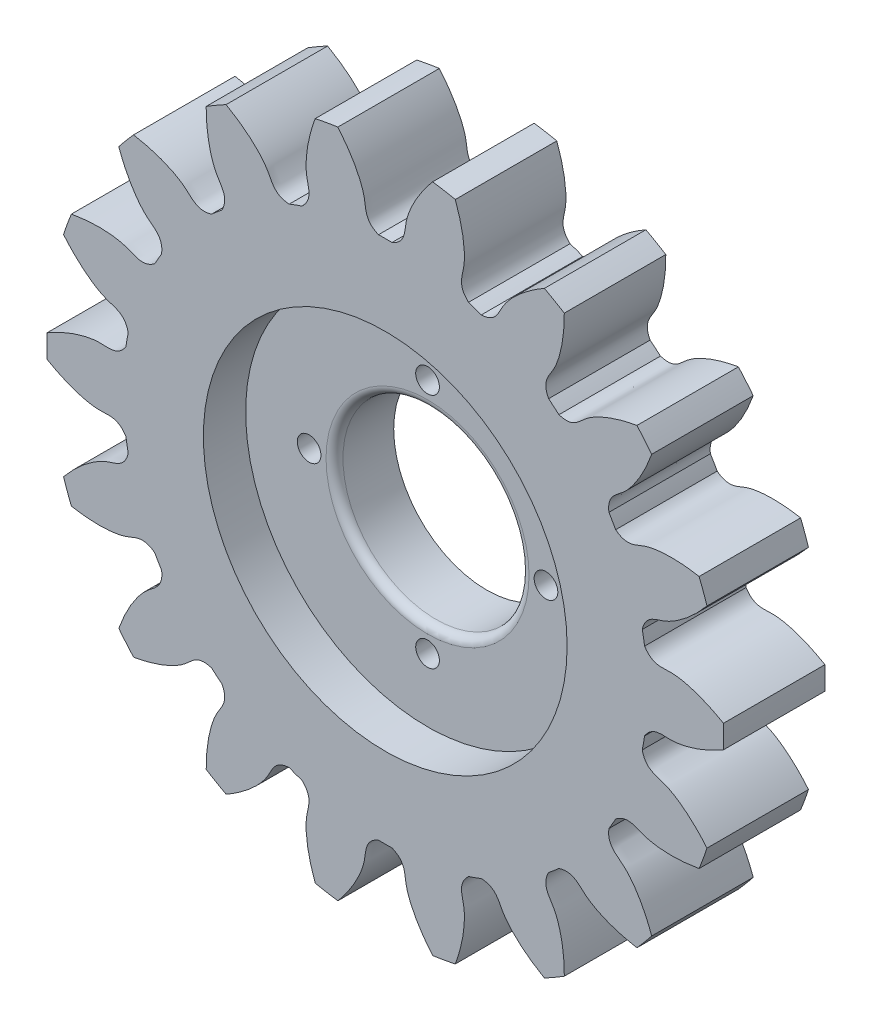
from build123d import *
from build123d.topology import SkipClean

# Parameters (mm, degrees)
SKETCH_1_R               = 20
EXTRUDE_1_DEPTH          = 5
CUT_EXTRUDE_1_DEPTH      = 29.722813233
PATTERN_CIRCULAR_1_COUNT = 18
SKETCH_4_R               = 10.75
CUT_EXTRUDE_2_DEPTH      = 2.5
SKETCH_5_R               = 5.5
CUT_EXTRUDE_3_DEPTH      = 12.5
EXTRUDE_START            = 1
SKETCH_7_R               = 5.5
EXTRUDE_2_DEPTH          = 1
SKETCH_9_R               = 0.7
CUT_EXTRUDE_4_DEPTH      = 11
FILLET_1_R               = 0.5


with BuildPart() as part:
    # 草图1 → 凸台-拉伸1 (new body)
    with BuildSketch(Plane.XY):
        Circle(SKETCH_1_R)
    extrude(amount=EXTRUDE_1_DEPTH)

    # 草图2 → 切除-拉伸1 (cut, through all)
    with BuildSketch(Plane.XY):
        with BuildLine():
            ThreePointArc((0.398807118, 15.494868598), (0, 15.5), (-0.398807118, 15.494868598))
            add(Edge.make_bspline(
                [(-0.398807118, 15.494868598), (-1.23020808, 15.837360781), (-1.1255781, 16.477399004), (-1.263665829, 17.085190913), (-1.27750304, 17.141013201), (-1.294215187, 17.203080949), (-1.314049419, 17.271300365), (-1.337260061, 17.345568336), (-1.364095436, 17.425774664), (-1.394801707, 17.511801464), (-1.429621434, 17.603523458), (-1.46879375, 17.700807993), (-1.512554053, 17.803515157), (-1.561133842, 17.911497864), (-1.614760517, 18.02460196), (-1.673657194, 18.142666331), (-1.738042511, 18.265523008), (-1.80813045, 18.392997287), (-1.884130152, 18.524907848), (-1.96624574, 18.661066879), (-2.054676143, 18.801280205), (-2.149614924, 18.945347423), (-2.25125011, 19.09306204), (-2.359764029, 19.244211611), (-2.475333142, 19.398577891), (-2.598127894, 19.555936981), (-2.728312549, 19.716059488), (-2.866045047, 19.878710674), (-3.011476851, 20.043650629), (-3.164752807, 20.210634428), (-3.326011005, 20.379412306), (-3.495382642, 20.549729829), (-3.672991892, 20.72132807), (-3.858955782, 20.893943792), (-4.053384065, 21.067309626), (-4.256379108, 21.241154261), (-4.468035775, 21.415202635), (-4.68844132, 21.58917612), (-4.917675281, 21.762792726), (-5.155809396, 21.935767291), (-5.402907448, 22.107811691), (-5.748150706, 22.338079033), (-6.015110877, 22.504667558), (-6.197121782, 22.613356759)],
                knots=[0, 0, 0, 0, 0.187591972, 0.192996016, 0.1991206, 0.205965723, 0.213531386, 0.221817587, 0.230824328, 0.240551609, 0.250999428, 0.262167787, 0.274056685, 0.286666122, 0.299996099, 0.314046614, 0.32881767, 0.344309264, 0.360521397, 0.37745407, 0.395107283, 0.413481034, 0.432575325, 0.452390155, 0.472925524, 0.494181432, 0.51615788, 0.538854867, 0.562272393, 0.586410459, 0.611269064, 0.636848208, 0.663147891, 0.690168114, 0.717908876, 0.746370177, 0.775552017, 0.805454397, 0.836077316, 0.867420774, 0.899484772, 0.932269309, 1, 1, 1, 1], degree=3))
            ThreePointArc((-6.197121782, 22.613356759), (0, 23.447136761), (6.197121782, 22.613356759))
            add(Edge.make_bspline(
                [(0.398807118, 15.494868598), (1.23020808, 15.837360781), (1.1255781, 16.477399004), (1.263665829, 17.085190913), (1.27750304, 17.141013201), (1.294215187, 17.203080949), (1.314049419, 17.271300365), (1.337260061, 17.345568336), (1.364095436, 17.425774664), (1.394801707, 17.511801464), (1.429621434, 17.603523458), (1.46879375, 17.700807993), (1.512554053, 17.803515157), (1.561133842, 17.911497864), (1.614760517, 18.02460196), (1.673657194, 18.142666331), (1.738042511, 18.265523008), (1.80813045, 18.392997287), (1.884130152, 18.524907848), (1.96624574, 18.661066879), (2.054676143, 18.801280205), (2.149614924, 18.945347423), (2.25125011, 19.09306204), (2.359764029, 19.244211611), (2.475333142, 19.398577891), (2.598127894, 19.555936981), (2.728312549, 19.716059488), (2.866045047, 19.878710674), (3.011476851, 20.043650629), (3.164752807, 20.210634428), (3.326011005, 20.379412306), (3.495382642, 20.549729829), (3.672991892, 20.72132807), (3.858955782, 20.893943792), (4.053384065, 21.067309626), (4.256379108, 21.241154261), (4.468035775, 21.415202635), (4.68844132, 21.58917612), (4.917675281, 21.762792726), (5.155809396, 21.935767291), (5.402907448, 22.107811691), (5.748150706, 22.338079033), (6.015110877, 22.504667558), (6.197121782, 22.613356759)],
                knots=[0, 0, 0, 0, 0.187591972, 0.192996016, 0.1991206, 0.205965723, 0.213531386, 0.221817587, 0.230824328, 0.240551609, 0.250999428, 0.262167787, 0.274056685, 0.286666122, 0.299996099, 0.314046614, 0.32881767, 0.344309264, 0.360521397, 0.37745407, 0.395107283, 0.413481034, 0.432575325, 0.452390155, 0.472925524, 0.494181432, 0.51615788, 0.538854867, 0.562272393, 0.586410459, 0.611269064, 0.636848208, 0.663147891, 0.690168114, 0.717908876, 0.746370177, 0.775552017, 0.805454397, 0.836077316, 0.867420774, 0.899484772, 0.932269309, 1, 1, 1, 1], degree=3))
        make_face()
    cut_extrude_1 = extrude(amount=CUT_EXTRUDE_1_DEPTH, mode=Mode.SUBTRACT)

    # 阵列(圆周)1: 切除-拉伸1 ×18 about axis
    pattern_circular_1_axis = Axis((0, 0, -0.25), (0, 0, 1))
    for i in range(1, PATTERN_CIRCULAR_1_COUNT):
        add(cut_extrude_1.rotate(pattern_circular_1_axis, i * 360 / PATTERN_CIRCULAR_1_COUNT), mode=Mode.SUBTRACT)

    # 草图4 → 切除-拉伸2 (cut)
    with BuildSketch(Plane.XY.offset(5)):
        Circle(SKETCH_4_R)
    extrude(amount=-CUT_EXTRUDE_2_DEPTH, mode=Mode.SUBTRACT)

    # 草图5 → 切除-拉伸3 (cut)
    with BuildSketch(Plane.XY.offset(2.5)):
        Circle(SKETCH_5_R)
    extrude(amount=-CUT_EXTRUDE_3_DEPTH, mode=Mode.SUBTRACT)

    # 草图7 → 凸台-拉伸2 (add)
    with BuildSketch(Plane(origin=(0, 0, 0), x_dir=(-1, 0, 0), z_dir=(0, 0, -1)).offset(EXTRUDE_START)):
        with BuildLine():
            ThreePointArc((5.674313285, 14.424013614), (5.301312222, 14.565235622), (4.924801073, 14.69681375))
            add(Edge.make_bspline(
                [(4.924801073, 14.69681375), (4.26067895, 15.303007003), (4.577904934, 15.868660637), (4.658707402, 16.508284432), (4.666369027, 16.589127112), (4.672330084, 16.679144875), (4.675920357, 16.756872447), (4.678135533, 16.841419979), (4.678921527, 16.967718525), (4.674597452, 17.142482832), (4.659749506, 17.37208574), (4.632937235, 17.62783527), (4.592050527, 17.909098716), (4.53501208, 18.215116724), (4.459784588, 18.545004881), (4.364377308, 18.89775579), (4.256548047, 19.24134761), (4.177244393, 19.466051115), (4.139957978, 19.566827743)],
                knots=[0, 0, 0, 0, 0.187591972, 0.192996016, 0.205965723, 0.213531386, 0.221817587, 0.230824328, 0.240551609, 0.262167787, 0.286666122, 0.314046614, 0.344309264, 0.37745407, 0.413481034, 0.452390155, 0.494181432, 0.528511939, 0.528511939, 0.528511939, 0.528511939], degree=3))
            ThreePointArc((4.139957978, 19.566827743), (3.472963553, 19.69615506), (2.801961267, 19.802752664))
            add(Edge.make_bspline(
                [(2.801961267, 19.802752664), (2.689421233, 19.670068814), (2.500770995, 19.436321364), (2.253649449, 19.099646255), (2.056924342, 18.807881579), (1.886229548, 18.53152491), (1.739995333, 18.272154487), (1.634568569, 18.066379149), (1.545190776, 17.877872321), (1.483536019, 17.737420453), (1.429621434, 17.603523458), (1.394801707, 17.511801464), (1.364095436, 17.425774664), (1.337260061, 17.345568336), (1.314049419, 17.271300365), (1.288863092, 17.184672535), (1.268412839, 17.106084836), (1.1255781, 16.477399004), (1.23020808, 15.837360781), (0.398807118, 15.494868598)],
                knots=[0.471488061, 0.471488061, 0.471488061, 0.471488061, 0.527074476, 0.567424675, 0.604892717, 0.639478603, 0.67118233, 0.700003901, 0.713333878, 0.737832213, 0.749000572, 0.759448391, 0.769175672, 0.778182413, 0.786468614, 0.794034277, 0.807003984, 0.812408028, 1, 1, 1, 1], degree=3))
            ThreePointArc((0.398807118, 15.494868598), (0, 15.5), (-0.398807118, 15.494868598))
            add(Edge.make_bspline(
                [(-0.398807118, 15.494868598), (-1.23020808, 15.837360781), (-1.1255781, 16.477399004), (-1.268412839, 17.106084836), (-1.288863092, 17.184672535), (-1.314049419, 17.271300365), (-1.337260061, 17.345568336), (-1.364095436, 17.425774664), (-1.40655349, 17.544725301), (-1.470389704, 17.70747111), (-1.562871029, 17.918148971), (-1.675537813, 18.149304581), (-1.810156515, 18.399621688), (-1.968419446, 18.667676254), (-2.15193856, 18.951940403), (-2.362239993, 19.250786618), (-2.581081677, 19.536777536), (-2.73245586, 19.720806314), (-2.801961267, 19.802752664)],
                knots=[0, 0, 0, 0, 0.187591972, 0.192996016, 0.205965723, 0.213531386, 0.221817587, 0.230824328, 0.240551609, 0.262167787, 0.286666122, 0.314046614, 0.344309264, 0.37745407, 0.413481034, 0.452390155, 0.494181432, 0.528511939, 0.528511939, 0.528511939, 0.528511939], degree=3))
            ThreePointArc((-2.801961267, 19.802752664), (-3.472963553, 19.69615506), (-4.139957978, 19.566827743))
            add(Edge.make_bspline(
                [(-4.139957978, 19.566827743), (-4.200330468, 19.403654751), (-4.297657369, 19.119481815), (-4.414725993, 18.718590153), (-4.499797728, 18.377137091), (-4.565678818, 18.05906571), (-4.614384122, 17.765322191), (-4.643073564, 17.535898547), (-4.662588084, 17.328191066), (-4.672487236, 17.175122313), (-4.677354904, 17.030860421), (-4.678703975, 16.932760892), (-4.678135533, 16.841419979), (-4.675920357, 16.756872447), (-4.672330084, 16.679144875), (-4.666369027, 16.589127112), (-4.658707402, 16.508284432), (-4.577904934, 15.868660637), (-4.26067895, 15.303007003), (-4.924801073, 14.69681375)],
                knots=[0.471488061, 0.471488061, 0.471488061, 0.471488061, 0.527074476, 0.567424675, 0.604892717, 0.639478603, 0.67118233, 0.700003901, 0.713333878, 0.737832213, 0.749000572, 0.759448391, 0.769175672, 0.778182413, 0.786468614, 0.794034277, 0.807003984, 0.812408028, 1, 1, 1, 1], degree=3))
            ThreePointArc((-4.924801073, 14.69681375), (-5.301312222, 14.565235622), (-5.674313285, 14.424013614))
            add(Edge.make_bspline(
                [(-5.674313285, 14.424013614), (-6.572713859, 14.461495115), (-6.693299804, 15.098719871), (-7.042543773, 15.64063895), (-7.0886393, 15.707492833), (-7.141935169, 15.780282134), (-7.18914718, 15.842132691), (-7.241796363, 15.908323746), (-7.322377397, 16.005579273), (-7.438026162, 16.136677038), (-7.596986252, 16.303018993), (-7.781918273, 16.481699904), (-7.994031967, 16.670878735), (-8.234430536, 16.868638522), (-8.504106158, 17.072992212), (-8.803936288, 17.281888468), (-9.107394859, 17.475783759), (-9.312581611, 17.596941225), (-9.405922631, 17.650173355)],
                knots=[0, 0, 0, 0, 0.187591972, 0.192996016, 0.205965723, 0.213531386, 0.221817587, 0.230824328, 0.240551609, 0.262167787, 0.286666122, 0.314046614, 0.344309264, 0.37745407, 0.413481034, 0.452390155, 0.494181432, 0.528511939, 0.528511939, 0.528511939, 0.528511939], degree=3))
            ThreePointArc((-9.405922631, 17.650173355), (-10, 17.320508076), (-10.582537191, 16.970854622))
            add(Edge.make_bspline(
                [(-10.582537191, 16.970854622), (-10.583460325, 16.796873557), (-10.577724827, 16.496550586), (-10.550620325, 16.079795821), (-10.513777781, 15.729838651), (-10.466898937, 15.408416662), (-10.412200751, 15.11572985), (-10.3606925, 14.890329778), (-10.307990008, 14.688474232), (-10.264939571, 14.541250945), (-10.220173211, 14.404024268), (-10.187888908, 14.311379456), (-10.156114315, 14.225741493), (-10.12511577, 14.147050435), (-10.095157622, 14.075238355), (-10.058768173, 13.992688129), (-10.023918776, 13.919341289), (-9.729225071, 13.345927601), (-9.237665217, 12.922884731), (-9.654405572, 12.126106261)],
                knots=[0.471488061, 0.471488061, 0.471488061, 0.471488061, 0.527074476, 0.567424675, 0.604892717, 0.639478603, 0.67118233, 0.700003901, 0.713333878, 0.737832213, 0.749000572, 0.759448391, 0.769175672, 0.778182413, 0.786468614, 0.794034277, 0.807003984, 0.812408028, 1, 1, 1, 1], degree=3))
            ThreePointArc((-9.654405572, 12.126106261), (-9.96320795, 11.873688868), (-10.265413525, 11.613409713))
            add(Edge.make_bspline(
                [(-10.265413525, 11.613409713), (-11.122453344, 11.341359709), (-11.453710769, 11.898912288), (-11.96723999, 12.288701175), (-12.033420992, 12.335757676), (-12.108398133, 12.385928985), (-12.173917048, 12.427902038), (-12.246029772, 12.472094204), (-12.355014524, 12.535924168), (-12.508526891, 12.619561562), (-12.714792814, 12.721504317), (-12.94968454, 12.826158975), (-13.213709184, 12.93138177), (-13.507247776, 13.03499403), (-13.830553046, 13.134789189), (-14.183747935, 13.228539516), (-14.535221809, 13.306952546), (-14.76947258, 13.35062532), (-14.875390909, 13.368722651)],
                knots=[0, 0, 0, 0, 0.187591972, 0.192996016, 0.205965723, 0.213531386, 0.221817587, 0.230824328, 0.240551609, 0.262167787, 0.286666122, 0.314046614, 0.344309264, 0.37745407, 0.413481034, 0.452390155, 0.494181432, 0.528511939, 0.528511939, 0.528511939, 0.528511939], degree=3))
            ThreePointArc((-14.875390909, 13.368722651), (-15.320888862, 12.855752194), (-15.748706238, 12.32794597))
            add(Edge.make_bspline(
                [(-15.748706238, 12.32794597), (-15.690068671, 12.164141516), (-15.58196256, 11.883891893), (-15.413954136, 11.501540801), (-15.259641068, 11.185289523), (-15.105656569, 10.899285161), (-14.954152301, 10.642957405), (-14.828659013, 10.448767479), (-14.710096208, 10.277110626), (-14.6192887, 10.153490107), (-14.530287794, 10.039850208), (-14.468264081, 9.963834443), (-14.409115821, 9.894228632), (-14.353072792, 9.830885353), (-14.300360163, 9.773650361), (-14.237931425, 9.708524447), (-14.180097608, 9.651520159), (-13.707057076, 9.213478731), (-13.100452725, 8.98407184), (-13.219546276, 8.092811395)],
                knots=[0.471488061, 0.471488061, 0.471488061, 0.471488061, 0.527074476, 0.567424675, 0.604892717, 0.639478603, 0.67118233, 0.700003901, 0.713333878, 0.737832213, 0.749000572, 0.759448391, 0.769175672, 0.778182413, 0.786468614, 0.794034277, 0.807003984, 0.812408028, 1, 1, 1, 1], degree=3))
            ThreePointArc((-13.219546276, 8.092811395), (-13.423393759, 7.75), (-13.618353394, 7.402057204))
            add(Edge.make_bspline(
                [(-13.618353394, 7.402057204), (-14.330660805, 6.853288941), (-14.832635176, 7.263920274), (-15.448510447, 7.454564677), (-15.526794517, 7.476148088), (-15.614409582, 7.497650004), (-15.690332853, 7.514682984), (-15.773211257, 7.531546031), (-15.897454558, 7.554251597), (-16.07031467, 7.580340718), (-16.299007712, 7.605588472), (-16.555527735, 7.623593979), (-16.839618059, 7.632169317), (-17.150891588, 7.629136882), (-17.48883112, 7.612336741), (-17.852790251, 7.579633465), (-18.209886493, 7.533106466), (-18.444947182, 7.494026967), (-18.550667505, 7.474806694)],
                knots=[0, 0, 0, 0, 0.187591972, 0.192996016, 0.205965723, 0.213531386, 0.221817587, 0.230824328, 0.240551609, 0.262167787, 0.286666122, 0.314046614, 0.344309264, 0.37745407, 0.413481034, 0.452390155, 0.494181432, 0.528511939, 0.528511939, 0.528511939, 0.528511939], degree=3))
            ThreePointArc((-18.550667505, 7.474806694), (-18.793852416, 6.840402867), (-19.015348886, 6.198105093))
            add(Edge.make_bspline(
                [(-19.015348886, 6.198105093), (-18.904223174, 6.064234486), (-18.706785644, 5.83786045), (-18.418137592, 5.536030216), (-18.164966433, 5.291629401), (-17.922449083, 5.075539013), (-17.692412385, 4.886487223), (-17.508070402, 4.746929616), (-17.337947707, 4.626175805), (-17.210335854, 4.541068512), (-17.087835225, 4.464722041), (-17.003553076, 4.414503947), (-16.924165304, 4.369325776), (-16.849837405, 4.328970408), (-16.780728217, 4.29321589), (-16.699790019, 4.253369435), (-16.625947392, 4.219583257), (-16.031615703, 3.969748349), (-15.383132293, 3.961647294), (-15.190214598, 3.083404037)],
                knots=[0.471488061, 0.471488061, 0.471488061, 0.471488061, 0.527074476, 0.567424675, 0.604892717, 0.639478603, 0.67118233, 0.700003901, 0.713333878, 0.737832213, 0.749000572, 0.759448391, 0.769175672, 0.778182413, 0.786468614, 0.794034277, 0.807003984, 0.812408028, 1, 1, 1, 1], degree=3))
            ThreePointArc((-15.190214598, 3.083404037), (-15.264520172, 2.691546754), (-15.328718857, 2.297907354))
            add(Edge.make_bspline(
                [(-15.328718857, 2.297907354), (-15.810379076, 1.538610384), (-16.422524875, 1.75279227), (-17.066462548, 1.721297661), (-17.147407473, 1.714804704), (-17.237092791, 1.705043778), (-17.314262951, 1.695082256), (-17.397910678, 1.682582254), (-17.522426951, 1.661424795), (-17.693785328, 1.626818909), (-17.917321733, 1.57232641), (-18.164529951, 1.501511037), (-18.434420471, 1.412404606), (-18.725884755, 1.303093231), (-19.037698053, 1.171724137), (-19.368522583, 1.016511755), (-19.688170116, 0.85065657), (-19.895688935, 0.733538363), (-19.988459822, 0.679318733)],
                knots=[0, 0, 0, 0, 0.187591972, 0.192996016, 0.205965723, 0.213531386, 0.221817587, 0.230824328, 0.240551609, 0.262167787, 0.286666122, 0.314046614, 0.344309264, 0.37745407, 0.413481034, 0.452390155, 0.494181432, 0.528511939, 0.528511939, 0.528511939, 0.528511939], degree=3))
            ThreePointArc((-19.988459822, 0.679318733), (-20, 0), (-19.988459822, -0.679318733))
            add(Edge.make_bspline(
                [(-19.988459822, -0.679318733), (-19.838249366, -0.767108723), (-19.575294296, -0.912303121), (-19.200821831, -1.097207317), (-18.87932876, -1.240279323), (-18.57752973, -1.360392047), (-18.296706422, -1.459365435), (-18.075750108, -1.527458017), (-17.874586832, -1.582744093), (-17.725562507, -1.619072964), (-17.584337538, -1.648917497), (-17.487962626, -1.667280877), (-17.397910678, -1.682582254), (-17.314262951, -1.695082256), (-17.237092791, -1.705043778), (-17.147407473, -1.714804704), (-17.066462548, -1.721297661), (-16.422524875, -1.75279227), (-15.810379076, -1.538610384), (-15.328718857, -2.297907354)],
                knots=[0.471488061, 0.471488061, 0.471488061, 0.471488061, 0.527074476, 0.567424675, 0.604892717, 0.639478603, 0.67118233, 0.700003901, 0.713333878, 0.737832213, 0.749000572, 0.759448391, 0.769175672, 0.778182413, 0.786468614, 0.794034277, 0.807003984, 0.812408028, 1, 1, 1, 1], degree=3))
            ThreePointArc((-15.328718857, -2.297907354), (-15.264520172, -2.691546754), (-15.190214598, -3.083404037))
            add(Edge.make_bspline(
                [(-15.190214598, -3.083404037), (-15.383132293, -3.961647294), (-16.031615703, -3.969748349), (-16.625947392, -4.219583257), (-16.699790019, -4.253369435), (-16.780728217, -4.29321589), (-16.849837405, -4.328970408), (-16.924165304, -4.369325776), (-17.033936051, -4.431794358), (-17.183124343, -4.52292127), (-17.37454232, -4.650581422), (-17.582621776, -4.801676295), (-17.805759711, -4.977716946), (-18.042259856, -5.180122694), (-18.290337634, -5.410215692), (-18.548125243, -5.669216275), (-18.791769857, -5.934395063), (-18.946716973, -6.115425795), (-19.015348886, -6.198105093)],
                knots=[0, 0, 0, 0, 0.187591972, 0.192996016, 0.205965723, 0.213531386, 0.221817587, 0.230824328, 0.240551609, 0.262167787, 0.286666122, 0.314046614, 0.344309264, 0.37745407, 0.413481034, 0.452390155, 0.494181432, 0.528511939, 0.528511939, 0.528511939, 0.528511939], degree=3))
            ThreePointArc((-19.015348886, -6.198105093), (-18.793852416, -6.840402867), (-18.550667505, -7.474806694))
            add(Edge.make_bspline(
                [(-18.550667505, -7.474806694), (-18.379489904, -7.505927298), (-18.082733555, -7.552429472), (-17.667603584, -7.598105454), (-17.31656541, -7.622592056), (-16.991886117, -7.632239749), (-16.694147634, -7.629197083), (-16.463227582, -7.61761167), (-16.255286984, -7.600761695), (-16.10282472, -7.583930346), (-15.959909227, -7.56367325), (-15.863065787, -7.547967021), (-15.773211257, -7.531546031), (-15.690332853, -7.514682984), (-15.614409582, -7.497650004), (-15.526794517, -7.476148088), (-15.448510447, -7.454564677), (-14.832635176, -7.263920274), (-14.330660805, -6.853288941), (-13.618353394, -7.402057204)],
                knots=[0.471488061, 0.471488061, 0.471488061, 0.471488061, 0.527074476, 0.567424675, 0.604892717, 0.639478603, 0.67118233, 0.700003901, 0.713333878, 0.737832213, 0.749000572, 0.759448391, 0.769175672, 0.778182413, 0.786468614, 0.794034277, 0.807003984, 0.812408028, 1, 1, 1, 1], degree=3))
            ThreePointArc((-13.618353394, -7.402057204), (-13.423393759, -7.75), (-13.219546276, -8.092811395))
            add(Edge.make_bspline(
                [(-13.219546276, -8.092811395), (-13.100452725, -8.98407184), (-13.707057076, -9.213478731), (-14.180097608, -9.651520159), (-14.237931425, -9.708524447), (-14.300360163, -9.773650361), (-14.353072792, -9.830885353), (-14.409115821, -9.894228632), (-14.490901069, -9.990473704), (-14.599924966, -10.127130393), (-14.736136683, -10.3125605), (-14.879989922, -10.525710602), (-15.029461544, -10.767452371), (-15.182472142, -11.038539372), (-15.33689256, -11.339603662), (-15.490550257, -11.671153153), (-15.628804816, -12.00367107), (-15.712491321, -12.226779347), (-15.748706238, -12.32794597)],
                knots=[0, 0, 0, 0, 0.187591972, 0.192996016, 0.205965723, 0.213531386, 0.221817587, 0.230824328, 0.240551609, 0.262167787, 0.286666122, 0.314046614, 0.344309264, 0.37745407, 0.413481034, 0.452390155, 0.494181432, 0.528511939, 0.528511939, 0.528511939, 0.528511939], degree=3))
            ThreePointArc((-15.748706238, -12.32794597), (-15.320888862, -12.855752194), (-14.875390909, -13.368722651))
            add(Edge.make_bspline(
                [(-14.875390909, -13.368722651), (-14.703892706, -13.339420265), (-14.409128275, -13.281621366), (-14.003411599, -13.182559937), (-13.665168705, -13.085507689), (-13.356770264, -12.983526697), (-13.078028263, -12.878834968), (-12.864996838, -12.788968931), (-12.675359623, -12.702015261), (-12.537848619, -12.634053802), (-12.410480321, -12.56613838), (-12.324849101, -12.518256945), (-12.246029772, -12.472094204), (-12.173917048, -12.427902038), (-12.108398133, -12.385928985), (-12.033420992, -12.335757676), (-11.96723999, -12.288701175), (-11.453710769, -11.898912288), (-11.122453344, -11.341359709), (-10.265413525, -11.613409713)],
                knots=[0.471488061, 0.471488061, 0.471488061, 0.471488061, 0.527074476, 0.567424675, 0.604892717, 0.639478603, 0.67118233, 0.700003901, 0.713333878, 0.737832213, 0.749000572, 0.759448391, 0.769175672, 0.778182413, 0.786468614, 0.794034277, 0.807003984, 0.812408028, 1, 1, 1, 1], degree=3))
            ThreePointArc((-10.265413525, -11.613409713), (-9.96320795, -11.873688868), (-9.654405572, -12.126106261))
            add(Edge.make_bspline(
                [(-9.654405572, -12.126106261), (-9.237665217, -12.922884731), (-9.729225071, -13.345927601), (-10.023918776, -13.919341289), (-10.058768173, -13.992688129), (-10.095157622, -14.075238355), (-10.12511577, -14.147050435), (-10.156114315, -14.225741493), (-10.200049554, -14.344154478), (-10.255759166, -14.509858129), (-10.32033548, -14.730692583), (-10.382611678, -14.980188867), (-10.440388504, -15.258474129), (-10.491454219, -15.56554529), (-10.533591895, -15.901268075), (-10.564586295, -16.265376713), (-10.580775257, -16.62512719), (-10.583107324, -16.863402862), (-10.582537191, -16.970854622)],
                knots=[0, 0, 0, 0, 0.187591972, 0.192996016, 0.205965723, 0.213531386, 0.221817587, 0.230824328, 0.240551609, 0.262167787, 0.286666122, 0.314046614, 0.344309264, 0.37745407, 0.413481034, 0.452390155, 0.494181432, 0.528511939, 0.528511939, 0.528511939, 0.528511939], degree=3))
            ThreePointArc((-10.582537191, -16.970854622), (-10, -17.320508076), (-9.405922631, -17.650173355))
            add(Edge.make_bspline(
                [(-9.405922631, -17.650173355), (-9.254789042, -17.563982279), (-8.997569469, -17.408853707), (-8.650201506, -17.177003138), (-8.365550979, -16.970117974), (-8.110630793, -16.768808709), (-7.884505671, -16.575095284), (-7.715057608, -16.417787795), (-7.566596823, -16.271218325), (-7.460622936, -16.16032391), (-7.364164328, -16.052941766), (-7.300073718, -15.978660333), (-7.241796363, -15.908323746), (-7.18914718, -15.842132691), (-7.141935169, -15.780282134), (-7.0886393, -15.707492833), (-7.042543773, -15.64063895), (-6.693299804, -15.098719871), (-6.572713859, -14.461495115), (-5.674313285, -14.424013614)],
                knots=[0.471488061, 0.471488061, 0.471488061, 0.471488061, 0.527074476, 0.567424675, 0.604892717, 0.639478603, 0.67118233, 0.700003901, 0.713333878, 0.737832213, 0.749000572, 0.759448391, 0.769175672, 0.778182413, 0.786468614, 0.794034277, 0.807003984, 0.812408028, 1, 1, 1, 1], degree=3))
            ThreePointArc((-5.674313285, -14.424013614), (-5.301312222, -14.565235622), (-4.924801073, -14.69681375))
            add(Edge.make_bspline(
                [(-4.924801073, -14.69681375), (-4.26067895, -15.303007003), (-4.577904934, -15.868660637), (-4.658707402, -16.508284432), (-4.666369027, -16.589127112), (-4.672330084, -16.679144875), (-4.675920357, -16.756872447), (-4.678135533, -16.841419979), (-4.678921527, -16.967718525), (-4.674597452, -17.142482832), (-4.659749506, -17.37208574), (-4.632937235, -17.62783527), (-4.592050527, -17.909098716), (-4.53501208, -18.215116724), (-4.459784588, -18.545004881), (-4.364377308, -18.89775579), (-4.256548047, -19.24134761), (-4.177244393, -19.466051115), (-4.139957978, -19.566827743)],
                knots=[0, 0, 0, 0, 0.187591972, 0.192996016, 0.205965723, 0.213531386, 0.221817587, 0.230824328, 0.240551609, 0.262167787, 0.286666122, 0.314046614, 0.344309264, 0.37745407, 0.413481034, 0.452390155, 0.494181432, 0.528511939, 0.528511939, 0.528511939, 0.528511939], degree=3))
            ThreePointArc((-4.139957978, -19.566827743), (-3.472963553, -19.69615506), (-2.801961267, -19.802752664))
            add(Edge.make_bspline(
                [(-2.801961267, -19.802752664), (-2.689421233, -19.670068814), (-2.500770995, -19.436321364), (-2.253649449, -19.099646255), (-2.056924342, -18.807881579), (-1.886229548, -18.53152491), (-1.739995333, -18.272154487), (-1.634568569, -18.066379149), (-1.545190776, -17.877872321), (-1.483536019, -17.737420453), (-1.429621434, -17.603523458), (-1.394801707, -17.511801464), (-1.364095436, -17.425774664), (-1.337260061, -17.345568336), (-1.314049419, -17.271300365), (-1.288863092, -17.184672535), (-1.268412839, -17.106084836), (-1.1255781, -16.477399004), (-1.23020808, -15.837360781), (-0.398807118, -15.494868598)],
                knots=[0.471488061, 0.471488061, 0.471488061, 0.471488061, 0.527074476, 0.567424675, 0.604892717, 0.639478603, 0.67118233, 0.700003901, 0.713333878, 0.737832213, 0.749000572, 0.759448391, 0.769175672, 0.778182413, 0.786468614, 0.794034277, 0.807003984, 0.812408028, 1, 1, 1, 1], degree=3))
            ThreePointArc((-0.398807118, -15.494868598), (0, -15.5), (0.398807118, -15.494868598))
            add(Edge.make_bspline(
                [(0.398807118, -15.494868598), (1.23020808, -15.837360781), (1.1255781, -16.477399004), (1.268412839, -17.106084836), (1.288863092, -17.184672535), (1.314049419, -17.271300365), (1.337260061, -17.345568336), (1.364095436, -17.425774664), (1.40655349, -17.544725301), (1.470389704, -17.70747111), (1.562871029, -17.918148971), (1.675537813, -18.149304581), (1.810156515, -18.399621688), (1.968419446, -18.667676254), (2.15193856, -18.951940403), (2.362239993, -19.250786618), (2.581081677, -19.536777536), (2.73245586, -19.720806314), (2.801961267, -19.802752664)],
                knots=[0, 0, 0, 0, 0.187591972, 0.192996016, 0.205965723, 0.213531386, 0.221817587, 0.230824328, 0.240551609, 0.262167787, 0.286666122, 0.314046614, 0.344309264, 0.37745407, 0.413481034, 0.452390155, 0.494181432, 0.528511939, 0.528511939, 0.528511939, 0.528511939], degree=3))
            ThreePointArc((2.801961267, -19.802752664), (3.472963553, -19.69615506), (4.139957978, -19.566827743))
            add(Edge.make_bspline(
                [(4.139957978, -19.566827743), (4.200330468, -19.403654751), (4.297657369, -19.119481815), (4.414725993, -18.718590153), (4.499797728, -18.377137091), (4.565678818, -18.05906571), (4.614384122, -17.765322191), (4.643073564, -17.535898547), (4.662588084, -17.328191066), (4.672487236, -17.175122313), (4.677354904, -17.030860421), (4.678703975, -16.932760892), (4.678135533, -16.841419979), (4.675920357, -16.756872447), (4.672330084, -16.679144875), (4.666369027, -16.589127112), (4.658707402, -16.508284432), (4.577904934, -15.868660637), (4.26067895, -15.303007003), (4.924801073, -14.69681375)],
                knots=[0.471488061, 0.471488061, 0.471488061, 0.471488061, 0.527074476, 0.567424675, 0.604892717, 0.639478603, 0.67118233, 0.700003901, 0.713333878, 0.737832213, 0.749000572, 0.759448391, 0.769175672, 0.778182413, 0.786468614, 0.794034277, 0.807003984, 0.812408028, 1, 1, 1, 1], degree=3))
            ThreePointArc((4.924801073, -14.69681375), (5.301312222, -14.565235622), (5.674313285, -14.424013614))
            add(Edge.make_bspline(
                [(5.674313285, -14.424013614), (6.572713859, -14.461495115), (6.693299804, -15.098719871), (7.042543773, -15.64063895), (7.0886393, -15.707492833), (7.141935169, -15.780282134), (7.18914718, -15.842132691), (7.241796363, -15.908323746), (7.322377397, -16.005579273), (7.438026162, -16.136677038), (7.596986252, -16.303018993), (7.781918273, -16.481699904), (7.994031967, -16.670878735), (8.234430536, -16.868638522), (8.504106158, -17.072992212), (8.803936288, -17.281888468), (9.107394859, -17.475783759), (9.312581611, -17.596941225), (9.405922631, -17.650173355)],
                knots=[0, 0, 0, 0, 0.187591972, 0.192996016, 0.205965723, 0.213531386, 0.221817587, 0.230824328, 0.240551609, 0.262167787, 0.286666122, 0.314046614, 0.344309264, 0.37745407, 0.413481034, 0.452390155, 0.494181432, 0.528511939, 0.528511939, 0.528511939, 0.528511939], degree=3))
            ThreePointArc((9.405922631, -17.650173355), (10, -17.320508076), (10.582537191, -16.970854622))
            add(Edge.make_bspline(
                [(10.582537191, -16.970854622), (10.583460325, -16.796873557), (10.577724827, -16.496550586), (10.550620325, -16.079795821), (10.513777781, -15.729838651), (10.466898937, -15.408416662), (10.412200751, -15.11572985), (10.3606925, -14.890329778), (10.307990008, -14.688474232), (10.264939571, -14.541250945), (10.220173211, -14.404024268), (10.187888908, -14.311379456), (10.156114315, -14.225741493), (10.12511577, -14.147050435), (10.095157622, -14.075238355), (10.058768173, -13.992688129), (10.023918776, -13.919341289), (9.729225071, -13.345927601), (9.237665217, -12.922884731), (9.654405572, -12.126106261)],
                knots=[0.471488061, 0.471488061, 0.471488061, 0.471488061, 0.527074476, 0.567424675, 0.604892717, 0.639478603, 0.67118233, 0.700003901, 0.713333878, 0.737832213, 0.749000572, 0.759448391, 0.769175672, 0.778182413, 0.786468614, 0.794034277, 0.807003984, 0.812408028, 1, 1, 1, 1], degree=3))
            ThreePointArc((9.654405572, -12.126106261), (9.96320795, -11.873688868), (10.265413525, -11.613409713))
            add(Edge.make_bspline(
                [(10.265413525, -11.613409713), (11.122453344, -11.341359709), (11.453710769, -11.898912288), (11.96723999, -12.288701175), (12.033420992, -12.335757676), (12.108398133, -12.385928985), (12.173917048, -12.427902038), (12.246029772, -12.472094204), (12.355014524, -12.535924168), (12.508526891, -12.619561562), (12.714792814, -12.721504317), (12.94968454, -12.826158975), (13.213709184, -12.93138177), (13.507247776, -13.03499403), (13.830553046, -13.134789189), (14.183747935, -13.228539516), (14.535221809, -13.306952546), (14.76947258, -13.35062532), (14.875390909, -13.368722651)],
                knots=[0, 0, 0, 0, 0.187591972, 0.192996016, 0.205965723, 0.213531386, 0.221817587, 0.230824328, 0.240551609, 0.262167787, 0.286666122, 0.314046614, 0.344309264, 0.37745407, 0.413481034, 0.452390155, 0.494181432, 0.528511939, 0.528511939, 0.528511939, 0.528511939], degree=3))
            ThreePointArc((14.875390909, -13.368722651), (15.320888862, -12.855752194), (15.748706238, -12.32794597))
            add(Edge.make_bspline(
                [(15.748706238, -12.32794597), (15.690068671, -12.164141516), (15.58196256, -11.883891893), (15.413954136, -11.501540801), (15.259641068, -11.185289523), (15.105656569, -10.899285161), (14.954152301, -10.642957405), (14.828659013, -10.448767479), (14.710096208, -10.277110626), (14.6192887, -10.153490107), (14.530287794, -10.039850208), (14.468264081, -9.963834443), (14.409115821, -9.894228632), (14.353072792, -9.830885353), (14.300360163, -9.773650361), (14.237931425, -9.708524447), (14.180097608, -9.651520159), (13.707057076, -9.213478731), (13.100452725, -8.98407184), (13.219546276, -8.092811395)],
                knots=[0.471488061, 0.471488061, 0.471488061, 0.471488061, 0.527074476, 0.567424675, 0.604892717, 0.639478603, 0.67118233, 0.700003901, 0.713333878, 0.737832213, 0.749000572, 0.759448391, 0.769175672, 0.778182413, 0.786468614, 0.794034277, 0.807003984, 0.812408028, 1, 1, 1, 1], degree=3))
            ThreePointArc((13.219546276, -8.092811395), (13.423393759, -7.75), (13.618353394, -7.402057204))
            add(Edge.make_bspline(
                [(13.618353394, -7.402057204), (14.330660805, -6.853288941), (14.832635176, -7.263920274), (15.448510447, -7.454564677), (15.526794517, -7.476148088), (15.614409582, -7.497650004), (15.690332853, -7.514682984), (15.773211257, -7.531546031), (15.897454558, -7.554251597), (16.07031467, -7.580340718), (16.299007712, -7.605588472), (16.555527735, -7.623593979), (16.839618059, -7.632169317), (17.150891588, -7.629136882), (17.48883112, -7.612336741), (17.852790251, -7.579633465), (18.209886493, -7.533106466), (18.444947182, -7.494026967), (18.550667505, -7.474806694)],
                knots=[0, 0, 0, 0, 0.187591972, 0.192996016, 0.205965723, 0.213531386, 0.221817587, 0.230824328, 0.240551609, 0.262167787, 0.286666122, 0.314046614, 0.344309264, 0.37745407, 0.413481034, 0.452390155, 0.494181432, 0.528511939, 0.528511939, 0.528511939, 0.528511939], degree=3))
            ThreePointArc((18.550667505, -7.474806694), (18.793852416, -6.840402867), (19.015348886, -6.198105093))
            add(Edge.make_bspline(
                [(19.015348886, -6.198105093), (18.904223174, -6.064234486), (18.706785644, -5.83786045), (18.418137592, -5.536030216), (18.164966433, -5.291629401), (17.922449083, -5.075539013), (17.692412385, -4.886487223), (17.508070402, -4.746929616), (17.337947707, -4.626175805), (17.210335854, -4.541068512), (17.087835225, -4.464722041), (17.003553076, -4.414503947), (16.924165304, -4.369325776), (16.849837405, -4.328970408), (16.780728217, -4.29321589), (16.699790019, -4.253369435), (16.625947392, -4.219583257), (16.031615703, -3.969748349), (15.383132293, -3.961647294), (15.190214598, -3.083404037)],
                knots=[0.471488061, 0.471488061, 0.471488061, 0.471488061, 0.527074476, 0.567424675, 0.604892717, 0.639478603, 0.67118233, 0.700003901, 0.713333878, 0.737832213, 0.749000572, 0.759448391, 0.769175672, 0.778182413, 0.786468614, 0.794034277, 0.807003984, 0.812408028, 1, 1, 1, 1], degree=3))
            ThreePointArc((15.190214598, -3.083404037), (15.264520172, -2.691546754), (15.328718857, -2.297907354))
            add(Edge.make_bspline(
                [(15.328718857, -2.297907354), (15.810379076, -1.538610384), (16.422524875, -1.75279227), (17.066462548, -1.721297661), (17.147407473, -1.714804704), (17.237092791, -1.705043778), (17.314262951, -1.695082256), (17.397910678, -1.682582254), (17.522426951, -1.661424795), (17.693785328, -1.626818909), (17.917321733, -1.57232641), (18.164529951, -1.501511037), (18.434420471, -1.412404606), (18.725884755, -1.303093231), (19.037698053, -1.171724137), (19.368522583, -1.016511755), (19.688170116, -0.85065657), (19.895688935, -0.733538363), (19.988459822, -0.679318733)],
                knots=[0, 0, 0, 0, 0.187591972, 0.192996016, 0.205965723, 0.213531386, 0.221817587, 0.230824328, 0.240551609, 0.262167787, 0.286666122, 0.314046614, 0.344309264, 0.37745407, 0.413481034, 0.452390155, 0.494181432, 0.528511939, 0.528511939, 0.528511939, 0.528511939], degree=3))
            ThreePointArc((19.988459822, -0.679318733), (20, 0), (19.988459822, 0.679318733))
            add(Edge.make_bspline(
                [(19.988459822, 0.679318733), (19.838249366, 0.767108723), (19.575294296, 0.912303121), (19.200821831, 1.097207317), (18.87932876, 1.240279323), (18.57752973, 1.360392047), (18.296706422, 1.459365435), (18.075750108, 1.527458017), (17.874586832, 1.582744093), (17.725562507, 1.619072964), (17.584337538, 1.648917497), (17.487962626, 1.667280877), (17.397910678, 1.682582254), (17.314262951, 1.695082256), (17.237092791, 1.705043778), (17.147407473, 1.714804704), (17.066462548, 1.721297661), (16.422524875, 1.75279227), (15.810379076, 1.538610384), (15.328718857, 2.297907354)],
                knots=[0.471488061, 0.471488061, 0.471488061, 0.471488061, 0.527074476, 0.567424675, 0.604892717, 0.639478603, 0.67118233, 0.700003901, 0.713333878, 0.737832213, 0.749000572, 0.759448391, 0.769175672, 0.778182413, 0.786468614, 0.794034277, 0.807003984, 0.812408028, 1, 1, 1, 1], degree=3))
            ThreePointArc((15.328718857, 2.297907354), (15.264520172, 2.691546754), (15.190214598, 3.083404037))
            add(Edge.make_bspline(
                [(15.190214598, 3.083404037), (15.383132293, 3.961647294), (16.031615703, 3.969748349), (16.625947392, 4.219583257), (16.699790019, 4.253369435), (16.780728217, 4.29321589), (16.849837405, 4.328970408), (16.924165304, 4.369325776), (17.033936051, 4.431794358), (17.183124343, 4.52292127), (17.37454232, 4.650581422), (17.582621776, 4.801676295), (17.805759711, 4.977716946), (18.042259856, 5.180122694), (18.290337634, 5.410215692), (18.548125243, 5.669216275), (18.791769857, 5.934395063), (18.946716973, 6.115425795), (19.015348886, 6.198105093)],
                knots=[0, 0, 0, 0, 0.187591972, 0.192996016, 0.205965723, 0.213531386, 0.221817587, 0.230824328, 0.240551609, 0.262167787, 0.286666122, 0.314046614, 0.344309264, 0.37745407, 0.413481034, 0.452390155, 0.494181432, 0.528511939, 0.528511939, 0.528511939, 0.528511939], degree=3))
            ThreePointArc((19.015348886, 6.198105093), (18.793852416, 6.840402867), (18.550667505, 7.474806694))
            add(Edge.make_bspline(
                [(18.550667505, 7.474806694), (18.379489904, 7.505927298), (18.082733555, 7.552429472), (17.667603584, 7.598105454), (17.31656541, 7.622592056), (16.991886117, 7.632239749), (16.694147634, 7.629197083), (16.463227582, 7.61761167), (16.255286984, 7.600761695), (16.10282472, 7.583930346), (15.959909227, 7.56367325), (15.863065787, 7.547967021), (15.773211257, 7.531546031), (15.690332853, 7.514682984), (15.614409582, 7.497650004), (15.526794517, 7.476148088), (15.448510447, 7.454564677), (14.832635176, 7.263920274), (14.330660805, 6.853288941), (13.618353394, 7.402057204)],
                knots=[0.471488061, 0.471488061, 0.471488061, 0.471488061, 0.527074476, 0.567424675, 0.604892717, 0.639478603, 0.67118233, 0.700003901, 0.713333878, 0.737832213, 0.749000572, 0.759448391, 0.769175672, 0.778182413, 0.786468614, 0.794034277, 0.807003984, 0.812408028, 1, 1, 1, 1], degree=3))
            ThreePointArc((13.618353394, 7.402057204), (13.423393759, 7.75), (13.219546276, 8.092811395))
            add(Edge.make_bspline(
                [(13.219546276, 8.092811395), (13.100452725, 8.98407184), (13.707057076, 9.213478731), (14.180097608, 9.651520159), (14.237931425, 9.708524447), (14.300360163, 9.773650361), (14.353072792, 9.830885353), (14.409115821, 9.894228632), (14.490901069, 9.990473704), (14.599924966, 10.127130393), (14.736136683, 10.3125605), (14.879989922, 10.525710602), (15.029461544, 10.767452371), (15.182472142, 11.038539372), (15.33689256, 11.339603662), (15.490550257, 11.671153153), (15.628804816, 12.00367107), (15.712491321, 12.226779347), (15.748706238, 12.32794597)],
                knots=[0, 0, 0, 0, 0.187591972, 0.192996016, 0.205965723, 0.213531386, 0.221817587, 0.230824328, 0.240551609, 0.262167787, 0.286666122, 0.314046614, 0.344309264, 0.37745407, 0.413481034, 0.452390155, 0.494181432, 0.528511939, 0.528511939, 0.528511939, 0.528511939], degree=3))
            ThreePointArc((15.748706238, 12.32794597), (15.320888862, 12.855752194), (14.875390909, 13.368722651))
            add(Edge.make_bspline(
                [(14.875390909, 13.368722651), (14.703892706, 13.339420265), (14.409128275, 13.281621366), (14.003411599, 13.182559937), (13.665168705, 13.085507689), (13.356770264, 12.983526697), (13.078028263, 12.878834968), (12.864996838, 12.788968931), (12.675359623, 12.702015261), (12.537848619, 12.634053802), (12.410480321, 12.56613838), (12.324849101, 12.518256945), (12.246029772, 12.472094204), (12.173917048, 12.427902038), (12.108398133, 12.385928985), (12.033420992, 12.335757676), (11.96723999, 12.288701175), (11.453710769, 11.898912288), (11.122453344, 11.341359709), (10.265413525, 11.613409713)],
                knots=[0.471488061, 0.471488061, 0.471488061, 0.471488061, 0.527074476, 0.567424675, 0.604892717, 0.639478603, 0.67118233, 0.700003901, 0.713333878, 0.737832213, 0.749000572, 0.759448391, 0.769175672, 0.778182413, 0.786468614, 0.794034277, 0.807003984, 0.812408028, 1, 1, 1, 1], degree=3))
            ThreePointArc((10.265413525, 11.613409713), (9.96320795, 11.873688868), (9.654405572, 12.126106261))
            add(Edge.make_bspline(
                [(9.654405572, 12.126106261), (9.237665217, 12.922884731), (9.729225071, 13.345927601), (10.023918776, 13.919341289), (10.058768173, 13.992688129), (10.095157622, 14.075238355), (10.12511577, 14.147050435), (10.156114315, 14.225741493), (10.200049554, 14.344154478), (10.255759166, 14.509858129), (10.32033548, 14.730692583), (10.382611678, 14.980188867), (10.440388504, 15.258474129), (10.491454219, 15.56554529), (10.533591895, 15.901268075), (10.564586295, 16.265376713), (10.580775257, 16.62512719), (10.583107324, 16.863402862), (10.582537191, 16.970854622)],
                knots=[0, 0, 0, 0, 0.187591972, 0.192996016, 0.205965723, 0.213531386, 0.221817587, 0.230824328, 0.240551609, 0.262167787, 0.286666122, 0.314046614, 0.344309264, 0.37745407, 0.413481034, 0.452390155, 0.494181432, 0.528511939, 0.528511939, 0.528511939, 0.528511939], degree=3))
            ThreePointArc((10.582537191, 16.970854622), (10, 17.320508076), (9.405922631, 17.650173355))
            add(Edge.make_bspline(
                [(9.405922631, 17.650173355), (9.254789042, 17.563982279), (8.997569469, 17.408853707), (8.650201506, 17.177003138), (8.365550979, 16.970117974), (8.110630793, 16.768808709), (7.884505671, 16.575095284), (7.715057608, 16.417787795), (7.566596823, 16.271218325), (7.460622936, 16.16032391), (7.364164328, 16.052941766), (7.300073718, 15.978660333), (7.241796363, 15.908323746), (7.18914718, 15.842132691), (7.141935169, 15.780282134), (7.0886393, 15.707492833), (7.042543773, 15.64063895), (6.693299804, 15.098719871), (6.572713859, 14.461495115), (5.674313285, 14.424013614)],
                knots=[0.471488061, 0.471488061, 0.471488061, 0.471488061, 0.527074476, 0.567424675, 0.604892717, 0.639478603, 0.67118233, 0.700003901, 0.713333878, 0.737832213, 0.749000572, 0.759448391, 0.769175672, 0.778182413, 0.786468614, 0.794034277, 0.807003984, 0.812408028, 1, 1, 1, 1], degree=3))
        make_face()
        with Locations(Location((0, 0, 0), (0, 0, 180))):
            Circle(SKETCH_7_R, mode=Mode.SUBTRACT)
    extrude(amount=-EXTRUDE_2_DEPTH)

    # 草图9 → 切除-拉伸4 (cut)
    with SkipClean():  # the faces are left unmerged after this step: merging them gives an invalid solid
        with BuildSketch(Plane.XY.offset(2.5)):
            with Locations((0, 7)):
                Circle(SKETCH_9_R)
            with Locations((7, 0)):
                Circle(SKETCH_9_R)
            with Locations((0, -7)):
                Circle(SKETCH_9_R)
            with Locations((-7, 0)):
                Circle(SKETCH_9_R)
        extrude(amount=-CUT_EXTRUDE_4_DEPTH, mode=Mode.SUBTRACT)

    # 圆角1
    fillet_1_edges = [part.edges().sort_by_distance(p)[0] for p in [
        (-5.5, 0, 2.5),
    ]]
    fillet(fillet_1_edges, radius=FILLET_1_R)


solid = part.part
